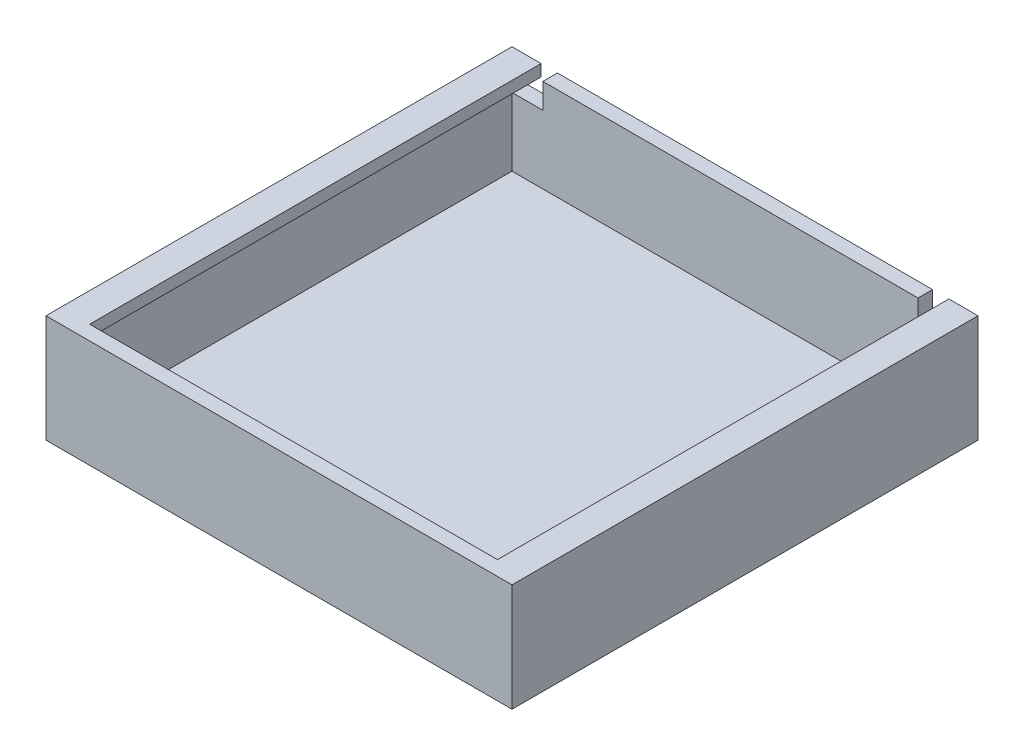
from build123d import *

# Parameters (mm, degrees)
SKETCH1_W           = 80
SKETCH1_H           = 80
BOSS_EXTRUDE1_DEPTH = 2.5
SKETCH2_W           = 80
SKETCH2_H           = 80
SKETCH2_W_2         = 75
SKETCH2_H_2         = 75
BOSS_EXTRUDE2_DEPTH = 16
BOSS_EXTRUDE3_REACH = 93.336
SKETCH4_W           = 5
SKETCH4_H           = 2
CUT_EXTRUDE2_DEPTH  = 2.5


with BuildPart() as part:
    # Sketch1 → Boss-Extrude1 (new body)
    with BuildSketch(Plane(origin=(0, 0, 0), x_dir=(1, 0, 0), z_dir=(0, 1, 0))):
        Rectangle(SKETCH1_W, SKETCH1_H)
    extrude(amount=BOSS_EXTRUDE1_DEPTH)

    # Sketch2 → Boss-Extrude2 (add)
    with BuildSketch(Plane(origin=(0, 2.5, 0), x_dir=(1, 0, 0), z_dir=(0, 1, 0))):
        Rectangle(SKETCH2_W, SKETCH2_H)
        Rectangle(SKETCH2_W_2, SKETCH2_H_2, mode=Mode.SUBTRACT)
    extrude(amount=BOSS_EXTRUDE2_DEPTH)

    # Sketch4 → Boss-Extrude3 (add, up to next)
    with BuildSketch(Plane.XY.offset(40), mode=Mode.PRIVATE) as boss_extrude3_sk1:
        with Locations((-37.5, 17.5)):
            Rectangle(SKETCH4_W, SKETCH4_H)
    boss_extrude3_tool1 = extrude(boss_extrude3_sk1.sketch, amount=-BOSS_EXTRUDE3_REACH, mode=Mode.PRIVATE) - part.part
    # Sketch4 → Boss-Extrude3 (add, up to next)
    with BuildSketch(Plane.XY.offset(40), mode=Mode.PRIVATE) as boss_extrude3_sk2:
        with Locations((37.5, 17.5)):
            Rectangle(SKETCH4_W, SKETCH4_H)
    boss_extrude3_tool2 = extrude(boss_extrude3_sk2.sketch, amount=-BOSS_EXTRUDE3_REACH, mode=Mode.PRIVATE) - part.part
    add(boss_extrude3_tool1.solids().sort_by_distance((-37.5, 17.5, 40))[0])
    add(boss_extrude3_tool2.solids().sort_by_distance((37.5, 17.5, 40))[0])

    # Sketch5 → Cut-Extrude2 (cut)
    with BuildSketch(Plane(origin=(0, 0, -40), x_dir=(-1, 0, 0), z_dir=(0, 0, -1))):
        Polygon((-32.2, 18.5), (-35, 18.5), (-35, 16.5), (-37.5, 16.5), (-37.5, 14.2), (-32.2, 14.2), align=None)
        Polygon((35, 18.5), (32.2, 18.5), (32.2, 14.2), (37.5, 14.2), (37.5, 16.5), (35, 16.5), align=None)
    extrude(amount=-CUT_EXTRUDE2_DEPTH, mode=Mode.SUBTRACT)


solid = part.part
